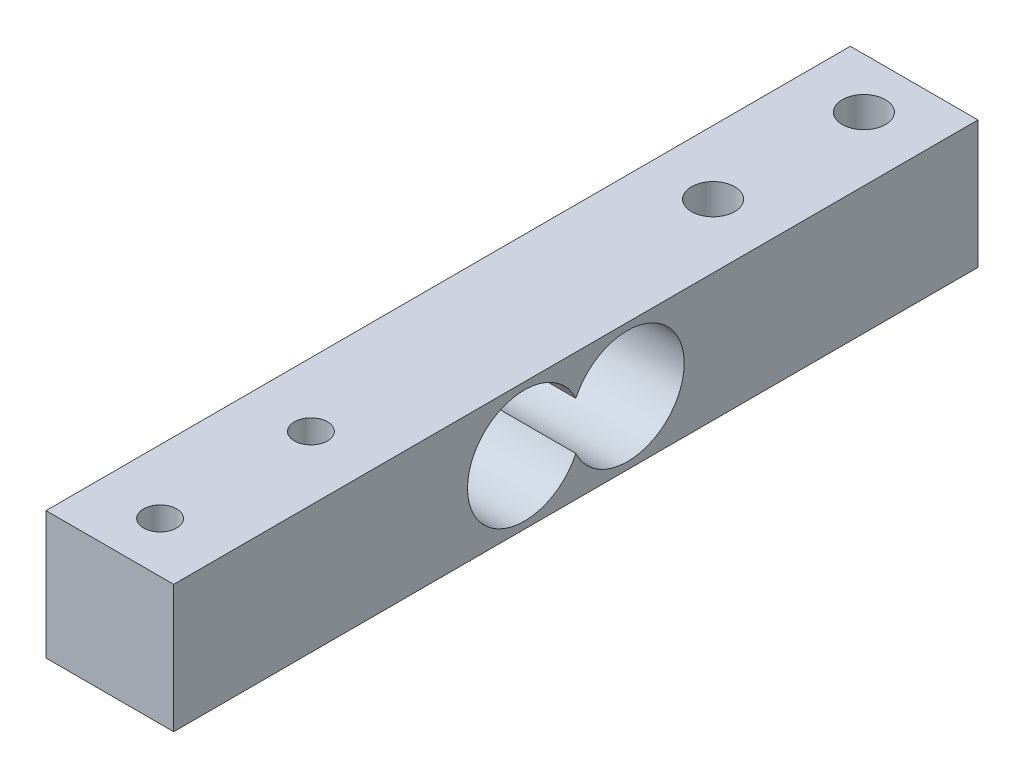
from build123d import *

# Parameters (mm, degrees)
SKETCH1_W           = 12.7
SKETCH1_H           = 12.7
BOSS_EXTRUDE1_DEPTH = 40
CUT_EXTRUDE1_DEPTH  = 43.445406112
SKETCH3_R           = 2.15
CUT_EXTRUDE2_DEPTH  = 43.445406112
SKETCH4_R           = 1.65
CUT_EXTRUDE3_DEPTH  = 43.445406112


with BuildPart() as part:
    # Sketch1 → Boss-Extrude1 (new, symmetric)
    with BuildSketch(Plane.XY):
        Rectangle(SKETCH1_W, SKETCH1_H)
    extrude(amount=BOSS_EXTRUDE1_DEPTH, both=True)

    # Sketch2 → Cut-Extrude1 (cut, through all)
    with BuildSketch(Plane(origin=(6.35, 0, 0), x_dir=(0, 0, -1), z_dir=(1, 0, 0))):
        with BuildLine():
            ThreePointArc((0, 2.375), (-10.776585121, 0), (0, -2.375))
            ThreePointArc((0, -2.375), (10.776585121, 0), (0, 2.375))
        make_face()
    extrude(amount=-CUT_EXTRUDE1_DEPTH, mode=Mode.SUBTRACT)

    # Sketch3 → Cut-Extrude2 (cut, through all)
    with BuildSketch(Plane(origin=(0, 6.35, 0), x_dir=(1, 0, 0), z_dir=(0, 1, 0))):
        with Locations((0, 35)):
            Circle(SKETCH3_R)
        with Locations((0, 20)):
            Circle(SKETCH3_R)
    extrude(amount=-CUT_EXTRUDE2_DEPTH, mode=Mode.SUBTRACT)

    # Sketch4 → Cut-Extrude3 (cut, through all)
    with BuildSketch(Plane(origin=(0, 6.35, 0), x_dir=(1, 0, 0), z_dir=(0, 1, 0))):
        with Locations((0, -35)):
            Circle(SKETCH4_R)
        with Locations((0, -20)):
            Circle(SKETCH4_R)
    extrude(amount=-CUT_EXTRUDE3_DEPTH, mode=Mode.SUBTRACT)


solid = part.part
